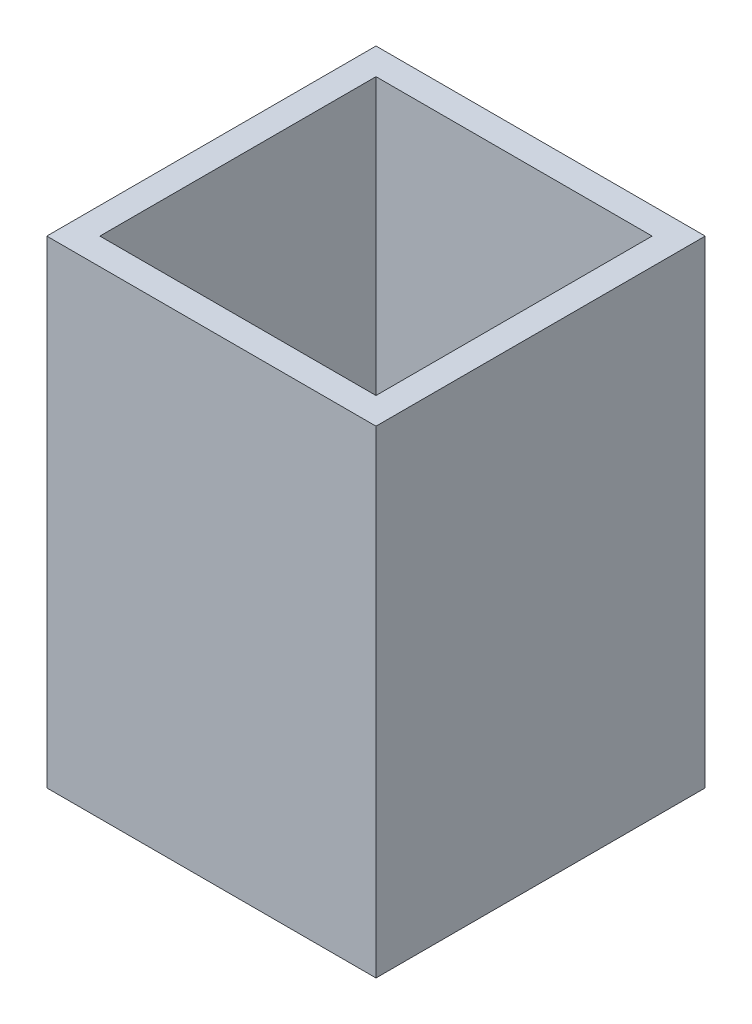
from build123d import *

# Parameters (mm, degrees)
SKETCH1_W           = 31
SKETCH1_H           = 31
SKETCH1_W_2         = 26
SKETCH1_H_2         = 26
BOSS_EXTRUDE1_DEPTH = 45


with BuildPart() as part:
    # Sketch1 → Boss-Extrude1 (new body)
    with BuildSketch(Plane(origin=(0, 0, 0), x_dir=(1, 0, 0), z_dir=(0, 1, 0))):
        Rectangle(SKETCH1_W, SKETCH1_H)
        Rectangle(SKETCH1_W_2, SKETCH1_H_2, mode=Mode.SUBTRACT)
    extrude(amount=-BOSS_EXTRUDE1_DEPTH)


solid = part.part
